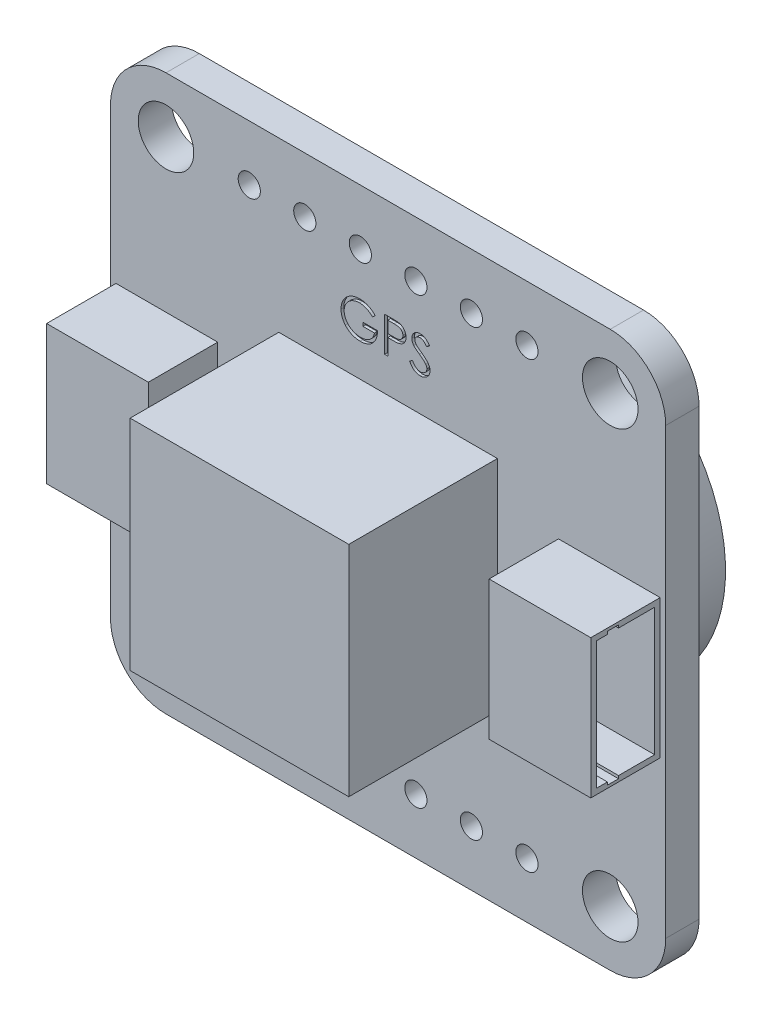
from build123d import *

# Parameters (mm, degrees)
SKETCH1_W           = 25.4
SKETCH1_H           = 25.4
BOSS_EXTRUDE1_DEPTH = 0.762
SKETCH2_R           = 1.27
SKETCH2_R_2         = 0.508
CUT_EXTRUDE1_DEPTH  = 19.025054119
SKETCH4_W           = 10
SKETCH4_H           = 10
BOSS_EXTRUDE2_DEPTH = 6.8
BOSS_EXTRUDE3_DEPTH = 4.2545
SKETCH6_W           = 4.652
SKETCH6_H           = 6.35
BOSS_EXTRUDE4_DEPTH = 3.175
CUT_EXTRUDE2_DEPTH  = 3.175
FILLET1_R           = 2.54
CUT_EXTRUDE3_DEPTH  = 0.127


with BuildPart() as part:
    # Sketch1 → Boss-Extrude1 (new, symmetric)
    with BuildSketch(Plane.XY):
        Rectangle(SKETCH1_W, SKETCH1_H)
    extrude(amount=BOSS_EXTRUDE1_DEPTH, both=True)

    # Sketch2 → Cut-Extrude1 (cut, through all)
    with BuildSketch(Plane.XY.offset(0.762)):
        with Locations((-10.16, 10.16)):
            Circle(SKETCH2_R)
        with Locations((10.16, 10.16)):
            Circle(SKETCH2_R)
        with Locations((-10.16, -10.16)):
            Circle(SKETCH2_R)
        with Locations((10.16, -10.16)):
            Circle(SKETCH2_R)
        with Locations((-6.35, 10.16)):
            Circle(SKETCH2_R_2)
        with Locations((-3.81, 10.16)):
            Circle(SKETCH2_R_2)
        with Locations((-1.27, 10.16)):
            Circle(SKETCH2_R_2)
        with Locations((1.27, 10.16)):
            Circle(SKETCH2_R_2)
        with Locations((3.81, 10.16)):
            Circle(SKETCH2_R_2)
        with Locations((6.35, 10.16)):
            Circle(SKETCH2_R_2)
        with Locations(Location((6.35, -10.16, 0), (0, 0, 180))):
            Circle(SKETCH2_R_2)
        with Locations(Location((3.81, -10.16, 0), (0, 0, 180))):
            Circle(SKETCH2_R_2)
        with Locations(Location((1.27, -10.16, 0), (0, 0, 180))):
            Circle(SKETCH2_R_2)
        with Locations(Location((-1.27, -10.16, 0), (0, 0, 180))):
            Circle(SKETCH2_R_2)
        with Locations(Location((-3.81, -10.16, 0), (0, 0, 180))):
            Circle(SKETCH2_R_2)
        with Locations(Location((-6.35, -10.16, 0), (0, 0, 180))):
            Circle(SKETCH2_R_2)
    extrude(amount=-CUT_EXTRUDE1_DEPTH, mode=Mode.SUBTRACT)

    # Sketch4 → Boss-Extrude2 (add)
    with BuildSketch(Plane.XY.offset(0.762)):
        Rectangle(SKETCH4_W, SKETCH4_H)
    extrude(amount=BOSS_EXTRUDE2_DEPTH)

    # Sketch5 → Boss-Extrude3 (add)
    with BuildSketch(Plane(origin=(0, 0, -0.762), x_dir=(-1, 0, 0), z_dir=(0, 0, -1))):
        with BuildLine():
            Line((2.442586649, 5.363916402), (2.442586649, 6.985))
            Line((2.442586649, 6.985), (5.603581137, 6.985))
            Line((5.603581137, 6.985), (5.603581137, -6.985))
            Line((5.603581137, -6.985), (2.442586649, -6.985))
            Line((2.442586649, -6.985), (2.442586649, -5.363916402))
            ThreePointArc((2.442586649, -5.363916402), (-9.657639722, 0), (2.442586649, 5.363916402))
        make_face()
        with BuildLine():
            Line((3.458586649, -5.969), (3.458586649, -2.045467962))
            ThreePointArc((3.458586649, -2.045467962), (-8.641639722, 0), (3.458586649, 2.045467962))
            Line((3.458586649, 2.045467962), (3.458586649, 5.969))
            Line((3.458586649, 5.969), (4.587581137, 5.969))
            Line((4.587581137, 5.969), (4.587581137, -5.969))
            Line((4.587581137, -5.969), (3.458586649, -5.969))
        make_face(mode=Mode.SUBTRACT)
    extrude(amount=BOSS_EXTRUDE3_DEPTH)

    # Sketch6 → Boss-Extrude4 (add)
    with BuildSketch(Plane.XY.offset(0.762)):
        with Locations((-10.12, 0.0381)):
            Rectangle(SKETCH6_W, SKETCH6_H)
        with Locations((10.12, 0.0381)):
            Rectangle(SKETCH6_W, SKETCH6_H)
    extrude(amount=BOSS_EXTRUDE4_DEPTH)

    # Sketch7 → Cut-Extrude2 (cut)
    with BuildSketch(Plane.ZY.offset(12.446)):
        Polygon((1.016, -2.8829), (2.667, -2.8829), (2.667, -3.0099), (3.175, -3.0099), (3.175, -2.8829), (3.683, -2.8829), (3.683, 2.9591), (3.175, 2.9591), (3.175, 3.0861), (2.667, 3.0861), (2.667, 2.9591), (1.016, 2.9591), align=None)
    cut_extrude2 = extrude(amount=-CUT_EXTRUDE2_DEPTH, mode=Mode.SUBTRACT)

    # Mirror1: Cut-Extrude2 across plane
    add(cut_extrude2.mirror(Plane(origin=(0, 0, 0), x_dir=(0, 0, 1), z_dir=(1, 0, 0))), mode=Mode.SUBTRACT)

    # Fillet1
    fillet1_edges = [part.edges().sort_by_distance(p)[0] for p in [
        (12.7, -12.7, 0),
        (-12.7, -12.7, 0),
        (-12.7, 12.7, 0),
        (12.7, 12.7, 0),
    ]]
    fillet(fillet1_edges, radius=FILLET1_R)

    # Sketch8 → Cut-Extrude3 (cut)
    # profile 1 of 3: a face of its own
    with BuildSketch(Plane.XY.offset(0.762)):
        with BuildLine():
            Line((-0.585695333, 7.866041281), (-0.707810718, 7.750286073))
            add(Edge.make_bspline(
                [(-0.707810718, 7.750286073), (-0.729908214, 7.771073643), (-0.773576278, 7.812153091), (-0.844768959, 7.865452721), (-0.919047465, 7.911111988), (-0.996024204, 7.948262317), (-1.073792905, 7.977904461), (-1.151321315, 7.999008297), (-1.227814186, 8.012466912), (-1.278690032, 8.014076351), (-1.303759236, 8.014869406)],
                knots=[0, 0, 0, 0, 1.08915593, 2.152340314, 3.188132944, 4.216796309, 5.218260357, 6.173443236, 7.099959455, 8, 8, 8, 8], degree=3))
            add(Edge.make_bspline(
                [(-1.303759236, 8.014869406), (-1.319141975, 8.014681806), (-1.349867557, 8.014307093), (-1.395506795, 8.009524538), (-1.440667377, 8.002646189), (-1.485264051, 7.99269398), (-1.529383527, 7.980080585), (-1.57287236, 7.964302893), (-1.615811675, 7.945908193), (-1.657797004, 7.924652714), (-1.698500733, 7.901302926), (-1.736944012, 7.875427338), (-1.773371875, 7.84785528), (-1.807099639, 7.817896443), (-1.838321313, 7.785822201), (-1.867780039, 7.752229201), (-1.894439741, 7.716199655), (-1.918520377, 7.678396461), (-1.940002254, 7.639483575), (-1.958965464, 7.59983554), (-1.974884501, 7.559583864), (-1.987479932, 7.518678035), (-1.99787155, 7.477434518), (-2.005182036, 7.435567734), (-2.009303514, 7.393032855), (-2.010016428, 7.364549813), (-2.010374821, 7.350230984)],
                knots=[0, 0, 0, 0, 1.02818874, 2.053710826, 3.065248034, 4.081641283, 5.106893873, 6.131558223, 7.173050175, 8.228653731, 9.27666206, 10.308777013, 11.325269123, 12.329503258, 13.32196095, 14.316845687, 15.314881793, 16.315733098, 17.311955233, 18.285320748, 19.252783886, 20.203351036, 21.145449891, 22.095197417, 23.042428769, 24, 24, 24, 24], degree=3))
            add(Edge.make_bspline(
                [(-2.010374821, 7.350230984), (-2.010032048, 7.335593864), (-2.00934744, 7.306359591), (-2.004965795, 7.262728709), (-1.996834057, 7.21974583), (-1.985962989, 7.177269712), (-1.972364548, 7.13522761), (-1.955413374, 7.093801793), (-1.935335763, 7.052993795), (-1.912096327, 7.013171304), (-1.88661187, 6.974380504), (-1.858062687, 6.937841007), (-1.827736637, 6.90306624), (-1.794528903, 6.870828304), (-1.759504325, 6.840264894), (-1.721616472, 6.812218068), (-1.681610356, 6.786147588), (-1.639424942, 6.762382024), (-1.595517965, 6.74115101), (-1.550497938, 6.7222716), (-1.504221036, 6.706723472), (-1.456930459, 6.694051546), (-1.408682582, 6.683664625), (-1.3592325, 6.676982393), (-1.308943807, 6.672133338), (-1.275044499, 6.671778795), (-1.257965966, 6.671600175)],
                knots=[0, 0, 0, 0, 0.93586088, 1.869166235, 2.799637598, 3.729985548, 4.670839027, 5.622275134, 6.589130586, 7.576015415, 8.568469353, 9.55398029, 10.53834874, 11.515998671, 12.510579167, 13.508179873, 14.527009472, 15.561807829, 16.601455013, 17.643573243, 18.680854198, 19.719860599, 20.772568776, 21.833555941, 22.908541556, 24, 24, 24, 24], degree=3))
            add(Edge.make_bspline(
                [(-1.257965966, 6.671600175), (-1.237383645, 6.672030422), (-1.196966912, 6.672875282), (-1.137555204, 6.679452199), (-1.080494525, 6.689724138), (-1.025945212, 6.704767241), (-0.973843906, 6.723954979), (-0.923999608, 6.74708503), (-0.876804748, 6.77504456), (-0.832117452, 6.806601278), (-0.790952585, 6.841759792), (-0.753825893, 6.879698527), (-0.721329546, 6.920233328), (-0.692979201, 6.963125453), (-0.669525632, 7.008729931), (-0.650274793, 7.056823272), (-0.635518622, 7.107427108), (-0.629461187, 7.142393669), (-0.626400462, 7.160061714)],
                knots=[0, 0, 0, 0, 1.13008108, 2.219097802, 3.278683437, 4.311054135, 5.322181354, 6.324827112, 7.324222904, 8.330512327, 9.32562643, 10.293043162, 11.24128371, 12.174520618, 13.111833804, 14.052305215, 15.015860969, 16, 16, 16, 16], degree=3))
            Line((-0.626400462, 7.160061714), (-1.155567128, 7.160061714))
            Line((-1.155567128, 7.160061714), (-1.155567128, 7.322882226))
            Line((-1.155567128, 7.322882226), (-0.483932513, 7.322882226))
            add(Edge.make_bspline(
                [(-0.483932513, 7.322882226), (-0.484706237, 7.292534901), (-0.486220555, 7.233139704), (-0.496842706, 7.146521045), (-0.513995195, 7.064709598), (-0.537426837, 6.987619205), (-0.567759553, 6.915359111), (-0.604667807, 6.847855951), (-0.648742305, 6.785545813), (-0.698413112, 6.727920015), (-0.754157022, 6.676517122), (-0.814467789, 6.631338715), (-0.879445056, 6.593282886), (-0.949027362, 6.5623218), (-1.022986916, 6.538158238), (-1.101494859, 6.52102613), (-1.184444728, 6.510761825), (-1.241293864, 6.509450378), (-1.27036831, 6.508779662)],
                knots=[0, 0, 0, 0, 1.140356446, 2.231883559, 3.274166699, 4.278491846, 5.25512956, 6.21435461, 7.1637429, 8.11826594, 9.068280886, 10.0076534, 10.945064095, 11.891975133, 12.864533718, 13.863980011, 14.907571808, 16, 16, 16, 16], degree=3))
            add(Edge.make_bspline(
                [(-1.27036831, 6.508779662), (-1.288288979, 6.509037799), (-1.323634313, 6.509546929), (-1.375836269, 6.513165226), (-1.426598905, 6.518735344), (-1.475914823, 6.527146883), (-1.523965428, 6.537449601), (-1.57051074, 6.550642505), (-1.615728066, 6.565913665), (-1.659687295, 6.583283489), (-1.701989429, 6.603409204), (-1.742822884, 6.625774648), (-1.782413377, 6.650264494), (-1.820491227, 6.67730227), (-1.857254834, 6.706685743), (-1.892467146, 6.738473806), (-1.926325291, 6.772569279), (-1.947534501, 6.796780472), (-1.958221375, 6.808979983)],
                knots=[0, 0, 0, 0, 1.107784379, 2.184907829, 3.233506516, 4.263428166, 5.276301166, 6.270063455, 7.25232949, 8.225834625, 9.190232166, 10.146266622, 11.1027726, 12.066435141, 13.031522626, 14.010570082, 14.99756817, 16, 16, 16, 16], degree=3))
            add(Edge.make_bspline(
                [(-1.958221375, 6.808979983), (-1.973727137, 6.828334172), (-2.004481281, 6.86672129), (-2.04406816, 6.928225551), (-2.07781451, 6.991907823), (-2.105195629, 7.057945387), (-2.126576119, 7.126276473), (-2.141909669, 7.196813765), (-2.150893689, 7.269648098), (-2.152187972, 7.318935557), (-2.152842769, 7.343870808)],
                knots=[0, 0, 0, 0, 1.023165419, 2.029347347, 3.013907458, 3.994755782, 4.975994455, 5.96558838, 6.970761222, 8, 8, 8, 8], degree=3))
            add(Edge.make_bspline(
                [(-2.152842769, 7.343870808), (-2.152601361, 7.362542644), (-2.152121613, 7.399649009), (-2.146304326, 7.454738573), (-2.137957968, 7.508849958), (-2.125690197, 7.561938932), (-2.110225106, 7.614040951), (-2.09092406, 7.665180206), (-2.068451911, 7.715386876), (-2.042332775, 7.76431538), (-2.013265895, 7.811316453), (-1.981719903, 7.856200886), (-1.947246841, 7.898151283), (-1.910409675, 7.937698923), (-1.870768897, 7.974346972), (-1.828695873, 8.008434729), (-1.784158178, 8.040007921), (-1.737015696, 8.068569238), (-1.687972068, 8.094224881), (-1.637144853, 8.11671713), (-1.584549567, 8.135305991), (-1.530580247, 8.151078384), (-1.47482838, 8.162742037), (-1.417698548, 8.171200575), (-1.358892961, 8.176988419), (-1.319143762, 8.177453899), (-1.298989103, 8.177689919)],
                knots=[0, 0, 0, 0, 1.008945113, 2.00506715, 2.99143336, 3.967273523, 4.948097931, 5.927297278, 6.919902385, 7.919676788, 8.923139349, 9.905703106, 10.883022732, 11.856032218, 12.825136022, 13.798837087, 14.781400844, 15.773989409, 16.776158564, 17.77167057, 18.775803737, 19.789618931, 20.80898985, 21.851988756, 22.910860228, 24, 24, 24, 24], degree=3))
            add(Edge.make_bspline(
                [(-1.298989103, 8.177689919), (-1.282552471, 8.177427078), (-1.249960562, 8.176905895), (-1.201462105, 8.173293358), (-1.153713273, 8.167567527), (-1.106643268, 8.159753948), (-1.06041238, 8.149111489), (-1.01488891, 8.136375981), (-0.970006867, 8.121547904), (-0.925906911, 8.103863678), (-0.882292518, 8.083791498), (-0.838921184, 8.061197553), (-0.795941097, 8.035695497), (-0.753277723, 8.007209608), (-0.710662031, 7.976229129), (-0.668768068, 7.941867998), (-0.62658459, 7.905481248), (-0.599460195, 7.879318258), (-0.585695333, 7.866041281)],
                knots=[0, 0, 0, 0, 0.985871117, 1.954866573, 2.915460327, 3.869826059, 4.81536089, 5.759505086, 6.70452669, 7.649098992, 8.607881297, 9.583363685, 10.581137262, 11.603961102, 12.659522466, 13.73993555, 14.853081303, 16, 16, 16, 16], degree=3))
        make_face()
    # profile 2 of 3: a face of its own
    with BuildSketch(Plane.XY.offset(0.762)):
        with BuildLine():
            Line((-0.158291487, 8.13698479), (0.153039142, 8.13698479))
            add(Edge.make_bspline(
                [(0.153039142, 8.13698479), (0.17445266, 8.136961252), (0.215481912, 8.136916151), (0.274316955, 8.135548748), (0.327752083, 8.133722356), (0.375672077, 8.131190568), (0.418224379, 8.128198544), (0.45521644, 8.124002083), (0.486939024, 8.119620449), (0.505946592, 8.115165739), (0.514615163, 8.113134129)],
                knots=[0, 0, 0, 0, 1.415646017, 2.712440637, 3.8905458, 4.950247383, 5.884950622, 6.709939814, 7.411656543, 8, 8, 8, 8], degree=3))
            add(Edge.make_bspline(
                [(0.514615163, 8.113134129), (0.525588659, 8.110130602), (0.547277074, 8.104194322), (0.578528618, 8.092304526), (0.60826197, 8.078206544), (0.636579141, 8.062139257), (0.663132157, 8.043413305), (0.688317183, 8.022787771), (0.71191196, 7.999786452), (0.733783805, 7.974667331), (0.753870124, 7.947852093), (0.771164659, 7.918940439), (0.785645937, 7.888419026), (0.798066206, 7.856309085), (0.807005398, 7.822340974), (0.813739528, 7.786750715), (0.818013816, 7.749542123), (0.818423192, 7.724114969), (0.81863159, 7.711170988)],
                knots=[0, 0, 0, 0, 0.999701418, 1.975846123, 2.934577507, 3.890451536, 4.834027766, 5.787354733, 6.749476667, 7.726910423, 8.712836071, 9.690891519, 10.682875813, 11.679750201, 12.712814741, 13.765529915, 14.8625177, 16, 16, 16, 16], degree=3))
            add(Edge.make_bspline(
                [(0.81863159, 7.711170988), (0.818440443, 7.698118211), (0.818066453, 7.672579571), (0.813577781, 7.635217627), (0.807531587, 7.599513215), (0.798234709, 7.5655455), (0.786058279, 7.533516204), (0.771774384, 7.502935859), (0.75454614, 7.474324722), (0.734750092, 7.447578923), (0.712728476, 7.422673355), (0.688574464, 7.399788502), (0.662385571, 7.37905832), (0.634245025, 7.360436336), (0.603878487, 7.34435438), (0.57174651, 7.329950174), (0.537569805, 7.317852943), (0.51391945, 7.311489308), (0.501894811, 7.308253821)],
                knots=[0, 0, 0, 0, 1.121902311, 2.195077645, 3.232258892, 4.234102512, 5.217864754, 6.176164875, 7.132989551, 8.084763148, 9.034132444, 9.988522005, 10.94243251, 11.903244335, 12.886203696, 13.894208494, 14.929344452, 16, 16, 16, 16], degree=3))
            add(Edge.make_bspline(
                [(0.501894811, 7.308253821), (0.491949199, 7.306138826), (0.470152811, 7.301503691), (0.434255934, 7.296329141), (0.392461419, 7.291912444), (0.344826314, 7.288600857), (0.291393375, 7.285765868), (0.232133697, 7.283512483), (0.166930955, 7.282274299), (0.121450784, 7.282210439), (0.097705608, 7.282177098)],
                knots=[0, 0, 0, 0, 0.601384939, 1.31797006, 2.144135048, 3.087295005, 4.142315834, 5.309527816, 6.595305764, 8, 8, 8, 8], degree=3))
            Line((0.097705608, 7.282177098), (-0.015823539, 7.282177098))
            Line((-0.015823539, 7.282177098), (-0.015823539, 6.54948479))
            Line((-0.015823539, 6.54948479), (-0.158291487, 6.54948479))
            Line((-0.158291487, 6.54948479), (-0.158291487, 8.13698479))
        make_face()
        with BuildLine():
            Line((-0.015823539, 7.974164278), (-0.015823539, 7.444997611))
            Line((-0.015823539, 7.444997611), (0.262116165, 7.441499514))
            add(Edge.make_bspline(
                [(0.262116165, 7.441499514), (0.275686988, 7.4414925), (0.301885183, 7.44147896), (0.33972947, 7.443286544), (0.374840111, 7.445373214), (0.407109258, 7.448428436), (0.436551457, 7.452747007), (0.4632158, 7.457106616), (0.486895532, 7.463413691), (0.514608385, 7.471905941), (0.545489046, 7.486389663), (0.57908397, 7.507412649), (0.607554914, 7.53420997), (0.632192142, 7.564339736), (0.651743736, 7.59785827), (0.666056633, 7.63372168), (0.674466372, 7.671562169), (0.675594038, 7.697455718), (0.676163641, 7.710534971)],
                knots=[0, 0, 0, 0, 1.160613943, 2.240541288, 3.23993089, 4.169200891, 5.011653406, 5.7853311, 6.478053781, 7.106038997, 8.262395093, 9.384106736, 10.481365981, 11.59014053, 12.70357646, 13.786202915, 14.881775077, 16, 16, 16, 16], degree=3))
            add(Edge.make_bspline(
                [(0.676163641, 7.710534971), (0.675590941, 7.723297797), (0.674452483, 7.748668714), (0.665990717, 7.785851938), (0.651771564, 7.821337418), (0.632060894, 7.854435925), (0.608139024, 7.884457275), (0.580335394, 7.910536329), (0.54871545, 7.931501173), (0.519302145, 7.945032697), (0.493175893, 7.953294626), (0.470482826, 7.959075321), (0.44486027, 7.963690685), (0.416299884, 7.967427888), (0.385023034, 7.970627137), (0.350761013, 7.972797919), (0.31364361, 7.97406858), (0.287875959, 7.974131606), (0.274518509, 7.974164278)],
                knots=[0, 0, 0, 0, 1.120700087, 2.227813068, 3.331159281, 4.466773991, 5.599788987, 6.693661531, 7.80175334, 8.91857717, 9.525282508, 10.207424825, 10.974604443, 11.810962634, 12.737642355, 13.736264703, 14.826523623, 16, 16, 16, 16], degree=3))
            Line((0.274518509, 7.974164278), (-0.015823539, 7.974164278))
        make_face(mode=Mode.SUBTRACT)
    # profile 3 of 3: a face of its own
    with BuildSketch(Plane.XY.offset(0.762)):
        with BuildLine():
            Line((0.981452102, 6.855727278), (1.115651822, 6.936183508))
            add(Edge.make_bspline(
                [(1.115651822, 6.936183508), (1.128133308, 6.91529002), (1.152047354, 6.875258901), (1.191939578, 6.821166861), (1.233274862, 6.775191883), (1.27635931, 6.737601422), (1.320929937, 6.708006391), (1.367277704, 6.687050379), (1.415246425, 6.673980276), (1.447891694, 6.672392736), (1.464189482, 6.671600175)],
                knots=[0, 0, 0, 0, 1.272034388, 2.437168799, 3.508375237, 4.49857839, 5.41946034, 6.295179144, 7.148887113, 8, 8, 8, 8], degree=3))
            add(Edge.make_bspline(
                [(1.464189482, 6.671600175), (1.478108165, 6.67198783), (1.505701988, 6.672756357), (1.546324862, 6.680140864), (1.585777322, 6.691485651), (1.62324624, 6.707733002), (1.658214608, 6.727390101), (1.688879074, 6.751132831), (1.715388561, 6.777714932), (1.737073409, 6.807370636), (1.753710425, 6.839264485), (1.766497542, 6.872001435), (1.7735937, 6.90609575), (1.774662656, 6.92905121), (1.775202102, 6.940635632)],
                knots=[0, 0, 0, 0, 1.095163259, 2.171163733, 3.241058638, 4.321873601, 5.38011039, 6.391990106, 7.366004449, 8.327778327, 9.272591725, 10.192022065, 11.087607919, 12, 12, 12, 12], degree=3))
            add(Edge.make_bspline(
                [(1.775202102, 6.940635632), (1.774533397, 6.953853089), (1.773174017, 6.980722247), (1.761684382, 7.020364232), (1.743609902, 7.059594791), (1.726935417, 7.083861436), (1.718278525, 7.096459951)],
                knots=[0, 0, 0, 0, 0.938893495, 1.908633276, 2.914225137, 4, 4, 4, 4], degree=3))
            add(Edge.make_bspline(
                [(1.718278525, 7.096459951), (1.711170782, 7.105552617), (1.696248965, 7.124641533), (1.670596093, 7.153055622), (1.64049432, 7.18236469), (1.606973779, 7.213687906), (1.568813414, 7.245568442), (1.527208434, 7.279526554), (1.481096612, 7.31427084), (1.448757198, 7.337571968), (1.432070592, 7.349594967)],
                knots=[0, 0, 0, 0, 0.722233717, 1.516239348, 2.393582979, 3.351407094, 4.387010283, 5.505090956, 6.712668013, 8, 8, 8, 8], degree=3))
            add(Edge.make_bspline(
                [(1.432070592, 7.349594967), (1.41536828, 7.361491505), (1.38343473, 7.384236779), (1.33877673, 7.417993508), (1.298842277, 7.448856263), (1.263808866, 7.477115583), (1.233691906, 7.5027753), (1.208254073, 7.525589008), (1.18814337, 7.546173695), (1.176960304, 7.559527446), (1.171939382, 7.565522952)],
                knots=[0, 0, 0, 0, 1.452282411, 2.77665338, 3.964542531, 5.026858415, 5.96415736, 6.766646006, 7.446254459, 8, 8, 8, 8], degree=3))
            add(Edge.make_bspline(
                [(1.171939382, 7.565522952), (1.164921478, 7.574866993), (1.151119827, 7.593243305), (1.132901674, 7.621965652), (1.117417125, 7.651367633), (1.105278496, 7.681528257), (1.095056711, 7.7120241), (1.088181507, 7.743253058), (1.083876481, 7.775075002), (1.083435615, 7.796489697), (1.083214923, 7.80720965)],
                knots=[0, 0, 0, 0, 1.068054152, 2.10047183, 3.106115577, 4.101338837, 5.06977816, 6.043150881, 7.020423561, 8, 8, 8, 8], degree=3))
            add(Edge.make_bspline(
                [(1.083214923, 7.80720965), (1.083806929, 7.824005298), (1.084978286, 7.857237598), (1.09488452, 7.905783725), (1.11052044, 7.952132564), (1.132425621, 7.995825251), (1.160663778, 8.035724107), (1.193341773, 8.072288081), (1.232263412, 8.103025974), (1.274968352, 8.129882872), (1.321711778, 8.150904059), (1.370693366, 8.166761361), (1.421990966, 8.175746274), (1.45673596, 8.177035671), (1.474365764, 8.177689919)],
                knots=[0, 0, 0, 0, 1.005424448, 1.989358655, 2.955360095, 3.929531133, 4.905563448, 5.876582895, 6.856512386, 7.866279853, 8.892233794, 9.918561126, 10.94386622, 12, 12, 12, 12], degree=3))
            add(Edge.make_bspline(
                [(1.474365764, 8.177689919), (1.49307291, 8.17704469), (1.530275452, 8.175761536), (1.584998489, 8.164604798), (1.637685671, 8.146144137), (1.680068866, 8.125194281), (1.713239797, 8.104270389), (1.738536715, 8.085211397), (1.764171416, 8.06326983), (1.790350676, 8.038387243), (1.816630904, 8.010335324), (1.843402256, 7.97930619), (1.870727335, 7.945489467), (1.888305886, 7.921348354), (1.897317487, 7.908972471)],
                knots=[0, 0, 0, 0, 1.286793592, 2.559021753, 3.825965368, 5.121522368, 5.803751409, 6.523245864, 7.299691795, 8.125521123, 9.008227632, 9.944561021, 10.946284179, 12, 12, 12, 12], degree=3))
            Line((1.897317487, 7.908972471), (1.768523917, 7.811343765))
            add(Edge.make_bspline(
                [(1.768523917, 7.811343765), (1.760747012, 7.821362564), (1.745770511, 7.840656428), (1.723033208, 7.867676275), (1.701602572, 7.892358035), (1.68048864, 7.913796147), (1.660806529, 7.933164614), (1.641703442, 7.949747075), (1.62345429, 7.963706006), (1.600450548, 7.978602907), (1.571550012, 7.993369606), (1.535271311, 8.005865081), (1.497358965, 8.013373984), (1.471537311, 8.014366801), (1.458465324, 8.014869406)],
                knots=[0, 0, 0, 0, 1.181633172, 2.275549214, 3.290209073, 4.226197932, 5.078386478, 5.862611352, 6.581680152, 7.217281963, 8.414376989, 9.595101626, 10.782541182, 12, 12, 12, 12], degree=3))
            add(Edge.make_bspline(
                [(1.458465324, 8.014869406), (1.442065758, 8.014319813), (1.410440741, 8.013259976), (1.365541598, 8.00168484), (1.325131139, 7.983459496), (1.290409083, 7.957916631), (1.261499811, 7.927653895), (1.240587692, 7.8928292), (1.228001011, 7.854374325), (1.226465091, 7.827549359), (1.225682872, 7.813887835)],
                knots=[0, 0, 0, 0, 1.14458467, 2.207223713, 3.21896685, 4.227309161, 5.202851033, 6.127160689, 7.046193047, 8, 8, 8, 8], degree=3))
            add(Edge.make_bspline(
                [(1.225682872, 7.813887835), (1.225861183, 7.8053827), (1.226218096, 7.788358523), (1.231195951, 7.763207342), (1.237591004, 7.738119699), (1.247724983, 7.713208385), (1.261715532, 7.688037729), (1.280087522, 7.662174298), (1.303225703, 7.63539013), (1.320949919, 7.617969643), (1.330307772, 7.60877215)],
                knots=[0, 0, 0, 0, 0.858281714, 1.717966888, 2.583508476, 3.4729293, 4.427298488, 5.488583878, 6.674047936, 8, 8, 8, 8], degree=3))
            add(Edge.make_bspline(
                [(1.330307772, 7.60877215), (1.333782751, 7.605671071), (1.342038507, 7.598303615), (1.357131517, 7.586242117), (1.377062714, 7.571363716), (1.401311641, 7.552954469), (1.430325409, 7.531599663), (1.464107208, 7.507572346), (1.502280474, 7.480092513), (1.529368629, 7.460880343), (1.543691686, 7.45072177)],
                knots=[0, 0, 0, 0, 0.420754252, 0.999615792, 1.744751191, 2.668019286, 3.750313428, 4.999500688, 6.413464383, 8, 8, 8, 8], degree=3))
            add(Edge.make_bspline(
                [(1.543691686, 7.45072177), (1.560921011, 7.438184439), (1.594283211, 7.413907635), (1.641752899, 7.37743338), (1.684794019, 7.341760999), (1.723557686, 7.307118299), (1.758426855, 7.273768057), (1.789014679, 7.241309043), (1.815632826, 7.209973801), (1.844289115, 7.169799811), (1.873570697, 7.120459819), (1.898717381, 7.060008618), (1.914573489, 6.99932243), (1.916646997, 6.958534187), (1.917670051, 6.93840957)],
                knots=[0, 0, 0, 0, 1.163667725, 2.253281268, 3.268753668, 4.215851969, 5.092017293, 5.902905408, 6.650798638, 7.335211899, 8.59617414, 9.77448103, 10.901945474, 12, 12, 12, 12], degree=3))
            add(Edge.make_bspline(
                [(1.917670051, 6.93840957), (1.917371992, 6.92417724), (1.916781662, 6.895988963), (1.909995819, 6.854598267), (1.900053685, 6.814397837), (1.88506894, 6.775884582), (1.866779507, 6.738353922), (1.843571959, 6.702790339), (1.816671688, 6.668406722), (1.785813516, 6.636119924), (1.752046982, 6.606480757), (1.716358306, 6.580115075), (1.678689075, 6.558131229), (1.639243638, 6.540192097), (1.598012936, 6.526161537), (1.555010834, 6.5159957), (1.510166448, 6.509756503), (1.47968623, 6.509108911), (1.464189482, 6.508779662)],
                knots=[0, 0, 0, 0, 0.983748083, 1.948392443, 2.894712957, 3.844097841, 4.80183111, 5.778335162, 6.776009319, 7.81870978, 8.863265674, 9.881300176, 10.883814829, 11.87499822, 12.874611388, 13.892143829, 14.928324115, 16, 16, 16, 16], degree=3))
            add(Edge.make_bspline(
                [(1.464189482, 6.508779662), (1.452199166, 6.50901152), (1.428369539, 6.509472314), (1.393122738, 6.513545967), (1.358587996, 6.519309546), (1.325198661, 6.528459927), (1.292524549, 6.539561985), (1.260707768, 6.553231871), (1.229732897, 6.569613602), (1.199426351, 6.588343845), (1.169865207, 6.610141465), (1.141326734, 6.635529444), (1.112874568, 6.663807584), (1.085348499, 6.695743804), (1.058191751, 6.730822148), (1.031939758, 6.769370814), (1.006049122, 6.811179828), (0.989804249, 6.840600777), (0.981452102, 6.855727278)],
                knots=[0, 0, 0, 0, 0.915332311, 1.819136955, 2.706846663, 3.586547465, 4.459518054, 5.340707479, 6.227863349, 7.133153174, 8.059268498, 9.028702269, 10.047606654, 11.120612155, 12.245963614, 13.433783089, 14.680604001, 16, 16, 16, 16], degree=3))
        make_face()
    extrude(amount=-CUT_EXTRUDE3_DEPTH, mode=Mode.SUBTRACT)


solid = part.part
